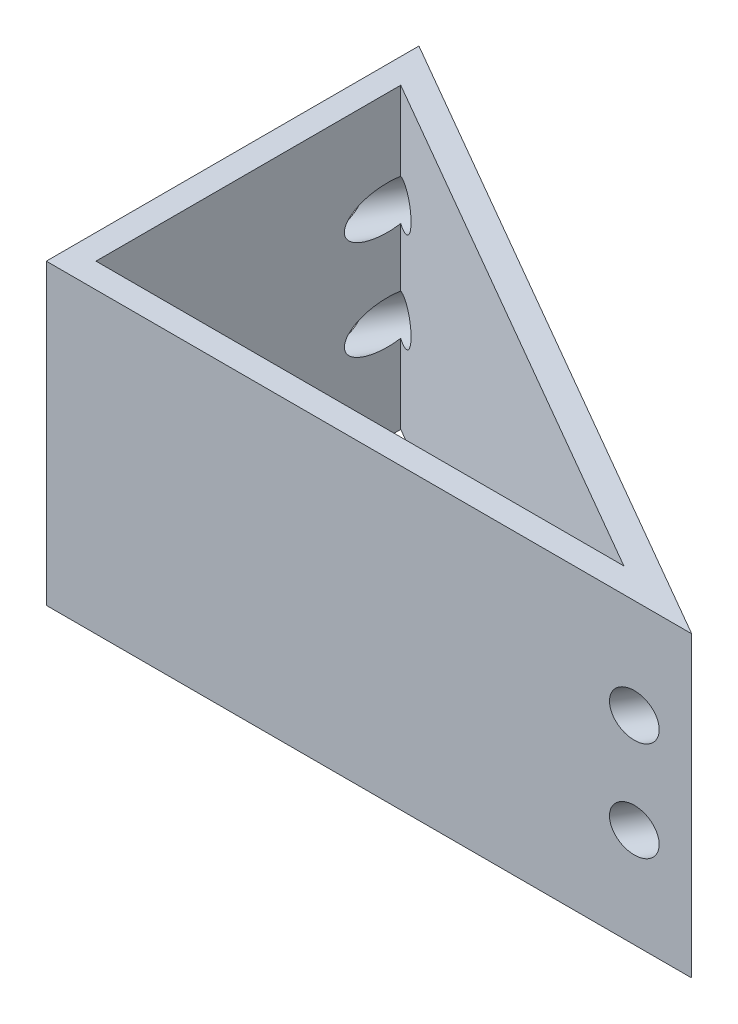
from build123d import *

# Parameters (mm, degrees)
BOSS_EXTRUDE1_DEPTH  = 38.1
CUT_EXTRUDE1_DEPTH   = 103.587389576
M5_CLEARANCE_HOLE1_D = 5.5


with BuildPart() as part:
    # Sketch1 → Boss-Extrude1 (new body)
    with BuildSketch(Plane(origin=(0, 0, 0), x_dir=(1, 0, 0), z_dir=(0, 1, 0))):
        Polygon((0, 0), (0, 47.625), (82.48891971, 0), align=None)
    extrude(amount=BOSS_EXTRUDE1_DEPTH)

    # Sketch2 → Cut-Extrude1 (cut, through all)
    with BuildSketch(Plane(origin=(0, 38.1, 0), x_dir=(1, 0, 0), z_dir=(0, 1, 0))):
        Polygon((3.175, 3.175), (70.639658396, 3.175), (3.175, 42.125738686), align=None)
    extrude(amount=-CUT_EXTRUDE1_DEPTH, mode=Mode.SUBTRACT)

    # M5 Clearance Hole1 (through all)
    with Locations(Plane(origin=(20.622229928, 0, -35.71875), x_dir=(-0.8660254037844417, 0, -0.4999999999999947), z_dir=(0.4999999999999947, 0, -0.8660254037844417))):
        with Locations((17.4625, 12.7), (-65.0875, 12.7), (-65.0875, 25.4), (17.4625, 25.4)):
            Hole(M5_CLEARANCE_HOLE1_D / 2)


solid = part.part
